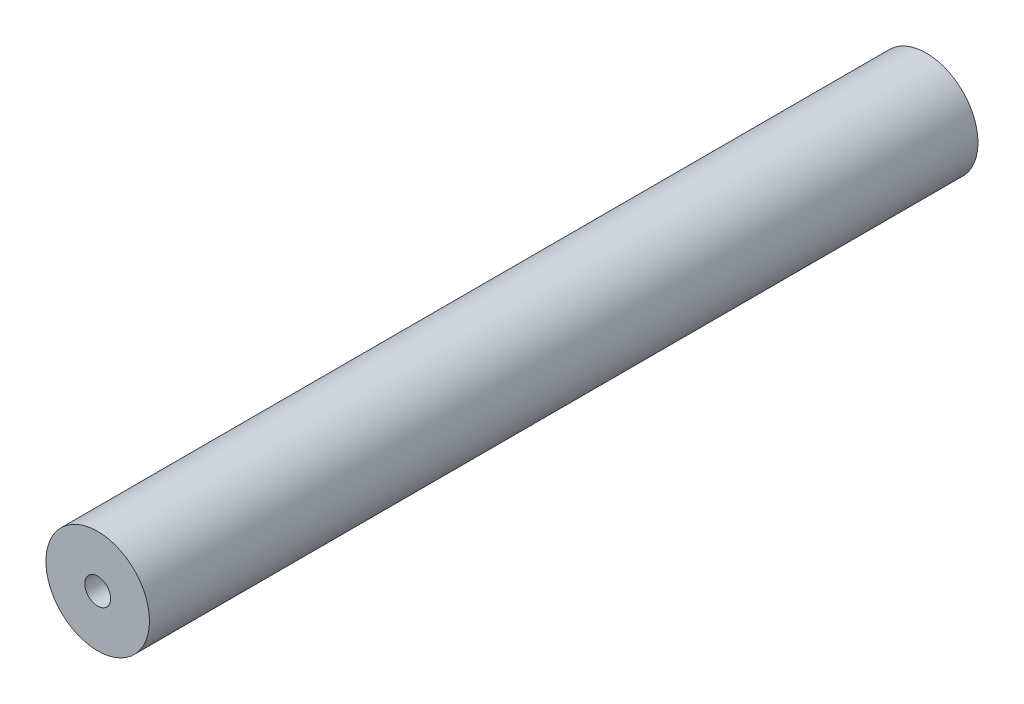
from build123d import *

# Parameters (mm, degrees)
SKETCH1_R           = 20
BOSS_EXTRUDE1_DEPTH = 320
SKETCH2_R           = 5
CUT_EXTRUDE1_DEPTH  = 322.247568084


with BuildPart() as part:
    # Sketch1 → Boss-Extrude1 (new body)
    with BuildSketch(Plane.XY):
        Circle(SKETCH1_R)
    extrude(amount=BOSS_EXTRUDE1_DEPTH)

    # Sketch2 → Cut-Extrude1 (cut, through all)
    with BuildSketch(Plane.XY.offset(320)):
        Circle(SKETCH2_R)
    extrude(amount=-CUT_EXTRUDE1_DEPTH, mode=Mode.SUBTRACT)


solid = part.part
